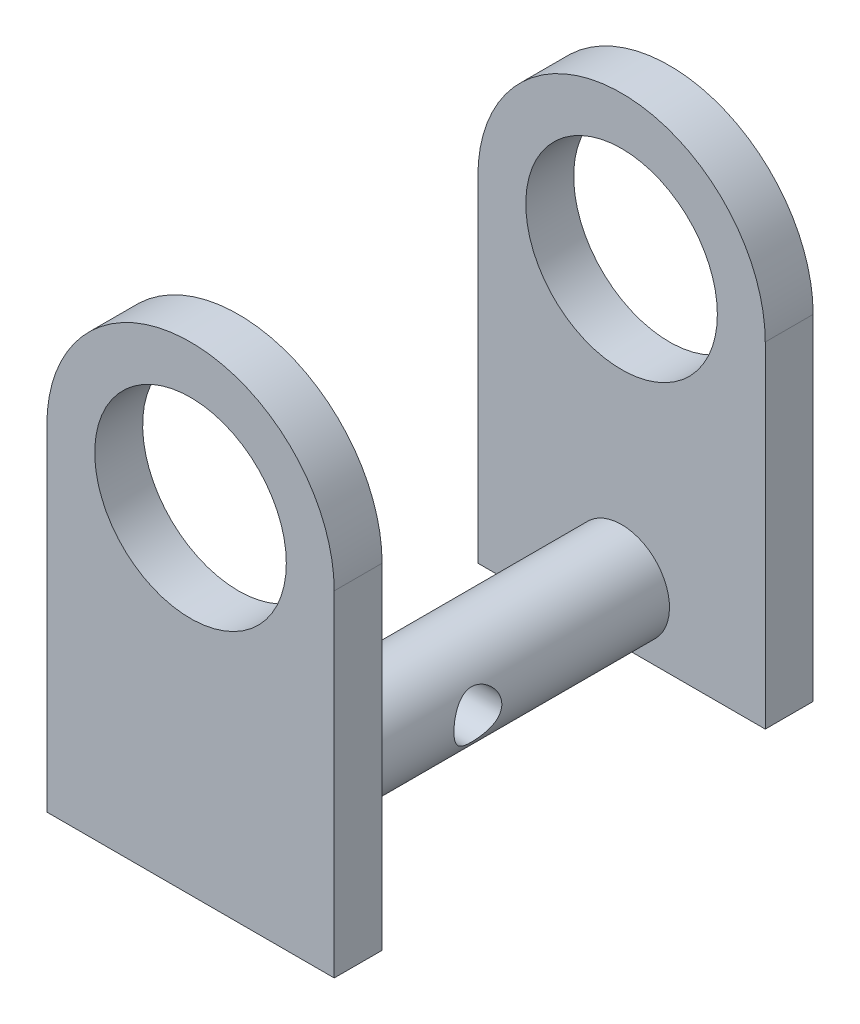
from build123d import *

# Parameters (mm, degrees)
SKETCH2_R           = 10
BOSS_EXTRUDE1_DEPTH = 50
SKETCH3_W           = 40
SKETCH3_H           = 50
CUT_EXTRUDE1_DEPTH  = 55
SKETCH4_R           = 5
BOSS_EXTRUDE2_DEPTH = 48
SKETCH5_R           = 2.5
CUT_EXTRUDE2_DEPTH  = 10


with BuildPart() as part:
    # Sketch2 → Boss-Extrude1 (new body)
    with BuildSketch(Plane.XY):
        with BuildLine():
            Line((15, 0), (15, -35))
            Line((15, -35), (-15, -35))
            Line((-15, -35), (-15, 0))
            ThreePointArc((-15, 0), (0, 15), (15, 0))
        make_face()
        Circle(SKETCH2_R, mode=Mode.SUBTRACT)
    extrude(amount=-BOSS_EXTRUDE1_DEPTH)

    # Sketch3 → Cut-Extrude1 (cut)
    with BuildSketch(Plane(origin=(15, 0, 0), x_dir=(0, 0, -1), z_dir=(1, 0, 0))):
        with Locations((25, -10)):
            Rectangle(SKETCH3_W, SKETCH3_H)
    extrude(amount=-CUT_EXTRUDE1_DEPTH, mode=Mode.SUBTRACT)


with BuildPart() as cut_extrude1_piece_1:
    # of the separate pieces the step leaves, piece 1, a body of its own (cut_extrude1_pieces)
    add(part.part.solids().sort_by_distance((15, 0, 0))[0])



with BuildPart() as cut_extrude1_piece_2:
    # of the separate pieces the step leaves, piece 2, a body of its own (cut_extrude1_pieces)
    add(part.part.solids().sort_by_distance((15, 0, -45))[0])


with BuildPart() as cut_extrude1_piece_1_1:
    add(cut_extrude1_piece_1.part)

    add(cut_extrude1_piece_2.part)  # Boss-Extrude2 merges Cut-Extrude1 piece 2
    # Sketch4 → Boss-Extrude2 (add)
    with BuildSketch(Plane(origin=(0, 0, -50), x_dir=(-1, 0, 0), z_dir=(0, 0, -1))):
        with Locations((0, -29)):
            Circle(SKETCH4_R)
    extrude(amount=-BOSS_EXTRUDE2_DEPTH)

    # Sketch5 → Cut-Extrude2 (cut, symmetric)
    with BuildSketch(Plane(origin=(0, 0, 0), x_dir=(0, 0, -1), z_dir=(1, 0, 0))):
        with Locations((25, -29)):
            Circle(SKETCH5_R)
    extrude(amount=CUT_EXTRUDE2_DEPTH, both=True, mode=Mode.SUBTRACT)


solid = cut_extrude1_piece_1_1.part
